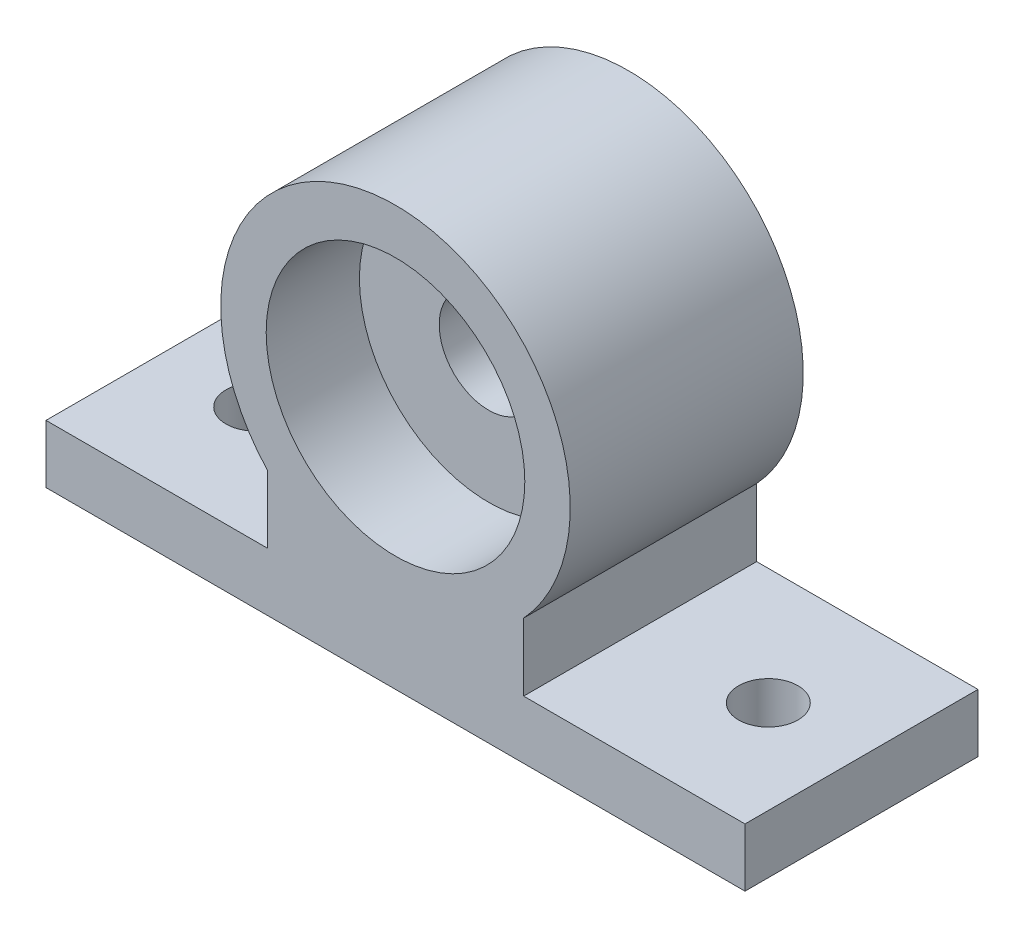
from build123d import *

# Parameters (mm, degrees)
SKETCH_1_W          = 60
SKETCH_1_H          = 20
SKETCH_1_R          = 2.55
EXTRUDE_1_DEPTH     = 5
SKETCH_3_W          = 22
SKETCH_3_H          = 20
EXTRUDE_2_DEPTH     = 16
SKETCH_4_R          = 15
EXTRUDE_3_DEPTH     = 20
SKETCH_5_R          = 4.25
CUT_EXTRUDE_1_DEPTH = 58.374334501
SKETCH_6_R          = 11.1
CUT_EXTRUDE_2_DEPTH = 8


with BuildPart() as part:
    # 草图1 → 凸台-拉伸1 (new body)
    with BuildSketch(Plane(origin=(0, 0, 0), x_dir=(1, 0, 0), z_dir=(0, 1, 0))):
        with Locations((9.947643979, -4.502617801)):
            Rectangle(SKETCH_1_W, SKETCH_1_H)
        with Locations(Location((-12.052356021, -4.502617801, 0), (0, 0, 270))):
            Circle(SKETCH_1_R, mode=Mode.SUBTRACT)
        with Locations(Location((31.947643979, -4.502617801, 0), (0, 0, 270))):
            Circle(SKETCH_1_R, mode=Mode.SUBTRACT)
    extrude(amount=EXTRUDE_1_DEPTH)

    # 草图3 → 凸台-拉伸2 (add)
    with BuildSketch(Plane(origin=(0, 5, 0), x_dir=(1, 0, 0), z_dir=(0, 1, 0))):
        with Locations((9.947643979, -4.502617801)):
            Rectangle(SKETCH_3_W, SKETCH_3_H)
    extrude(amount=EXTRUDE_2_DEPTH)

    # 草图4 → 凸台-拉伸3 (add)
    with BuildSketch(Plane(origin=(0, 0, -5.497382199), x_dir=(-1, 0, 0), z_dir=(0, 0, -1))):
        with Locations((-9.947643979, 21)):
            Circle(SKETCH_4_R)
    extrude(amount=-EXTRUDE_3_DEPTH)

    # 草图5 → 切除-拉伸1 (cut, through all)
    with BuildSketch(Plane.XY.offset(14.502617801)):
        with Locations((9.947643979, 21)):
            Circle(SKETCH_5_R)
    extrude(amount=-CUT_EXTRUDE_1_DEPTH, mode=Mode.SUBTRACT)

    # 草图6 → 切除-拉伸2 (cut)
    with BuildSketch(Plane.XY.offset(14.502617801)):
        with Locations((9.947643979, 21)):
            Circle(SKETCH_6_R)
    extrude(amount=-CUT_EXTRUDE_2_DEPTH, mode=Mode.SUBTRACT)


solid = part.part
